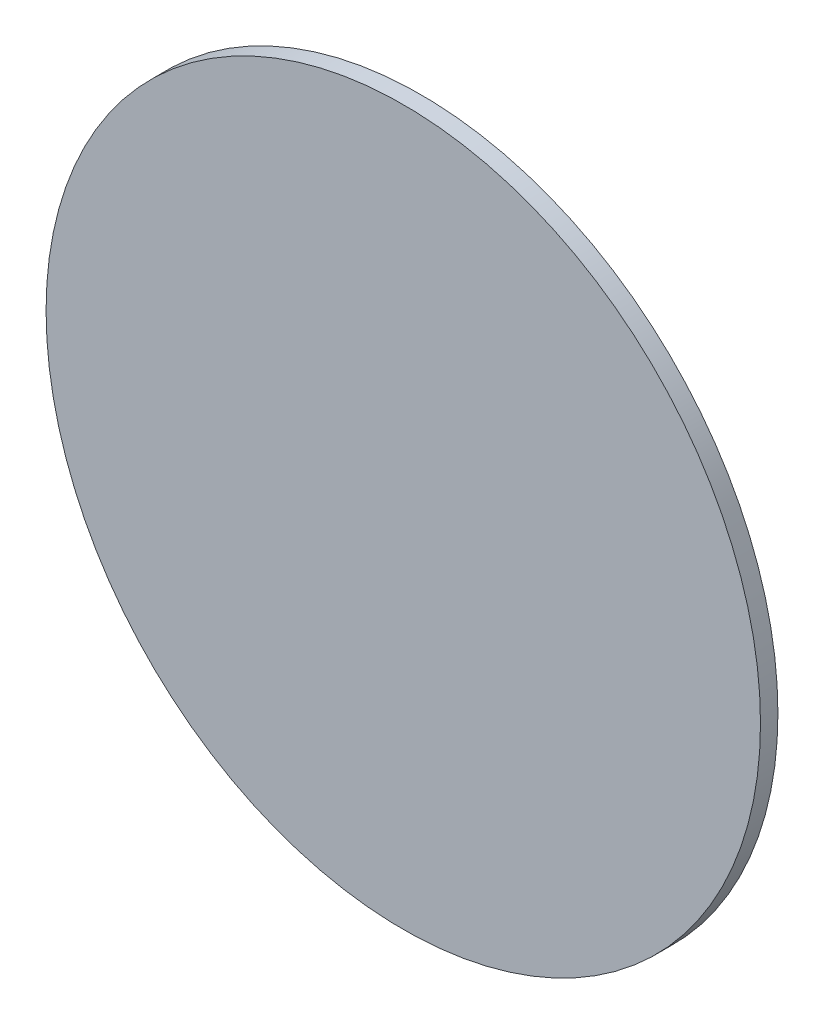
from build123d import *

# Parameters (mm, degrees)
SKETCH_1_R      = 4.1
EXTRUDE_1_DEPTH = 0.2


with BuildPart() as part:
    # 草图1 → 凸台-拉伸1 (new body)
    with BuildSketch(Plane.XY):
        Circle(SKETCH_1_R)
    extrude(amount=EXTRUDE_1_DEPTH)


solid = part.part
